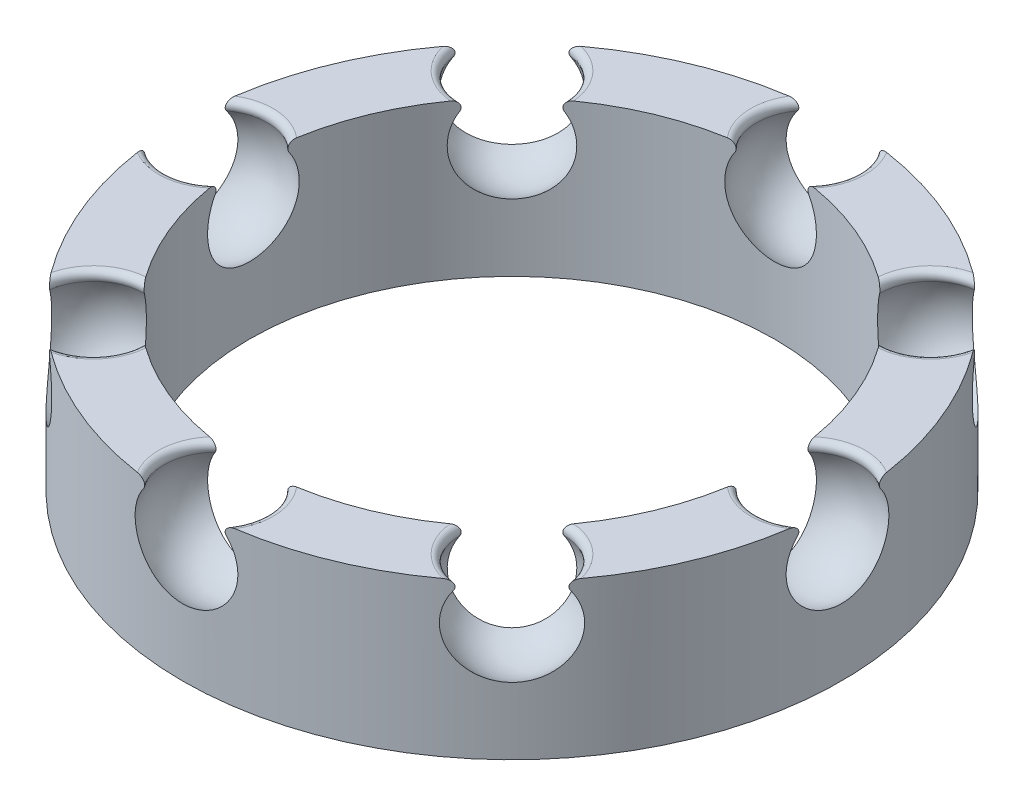
from build123d import *

# Parameters (mm, degrees)
SKETCH_1_W                       = 2.6
SKETCH_1_H                       = 6
FILLET_1_R                       = 0.25
PATTERN_CIRCULAR_2_COUNT         = 8
FILLET_1_OF_PATTERN_CIRCULAR_2_R = 0.25


with BuildPart() as part:
    # Эскиз1 → Повернуть1 (revolve)
    with BuildSketch(Plane.XY):
        with Locations((11.5, 3)):
            Rectangle(SKETCH_1_W, SKETCH_1_H)
    revolve(axis=Axis((0, 13.811694425, 0), (0, -1, 0)))

    # Эскиз1<5> → Вырез-Повернуть2 (revolve, cut)
    with BuildSketch(Plane.XY):
        with BuildLine():
            ThreePointArc((11.5, 2.2), (13.8, 4.5), (11.5, 6.8))
            Line((11.5, 6.8), (11.5, 2.2))
        make_face()
    cut_revolve_2 = revolve(axis=Axis((11.5, 6.8, 0), (0, -1, 0)), mode=Mode.SUBTRACT)

    # Скругление1
    fillet_1_edges = [part.edges().sort_by_distance(p)[0] for p in [
        (11.411778445, 6, 1.741326206),
        (11.411778445, 6, -1.741326206),
    ]]
    fillet(fillet_1_edges, radius=FILLET_1_R)

    # Круговой массив2: Вырез-Повернуть2 ×8 about axis
    pattern_circular_2_axis = Axis((0, 6, 0), (0, 1, 0))
    for i in range(1, PATTERN_CIRCULAR_2_COUNT):
        add(cut_revolve_2.rotate(pattern_circular_2_axis, i * 360 / PATTERN_CIRCULAR_2_COUNT), mode=Mode.SUBTRACT)

    # Скругление1 of Круговой массив2
    fillet_1_of_pattern_circular_2_edges = [part.edges().sort_by_distance(p)[0] for p in [
        (9.300649493, 6, -6.838042355),
        (6.838042355, 6, -9.300649493),
        (1.741326206, 6, -11.411778445),
        (-1.741326206, 6, -11.411778445),
        (-6.838042355, 6, -9.300649493),
        (-9.300649493, 6, -6.838042355),
        (-11.411778445, 6, -1.741326206),
        (-11.411778445, 6, 1.741326206),
        (-9.300649493, 6, 6.838042355),
        (-6.838042355, 6, 9.300649493),
        (-1.741326206, 6, 11.411778445),
        (1.741326206, 6, 11.411778445),
        (6.838042355, 6, 9.300649493),
        (9.300649493, 6, 6.838042355),
    ]]
    fillet(fillet_1_of_pattern_circular_2_edges, radius=FILLET_1_OF_PATTERN_CIRCULAR_2_R)


solid = part.part
